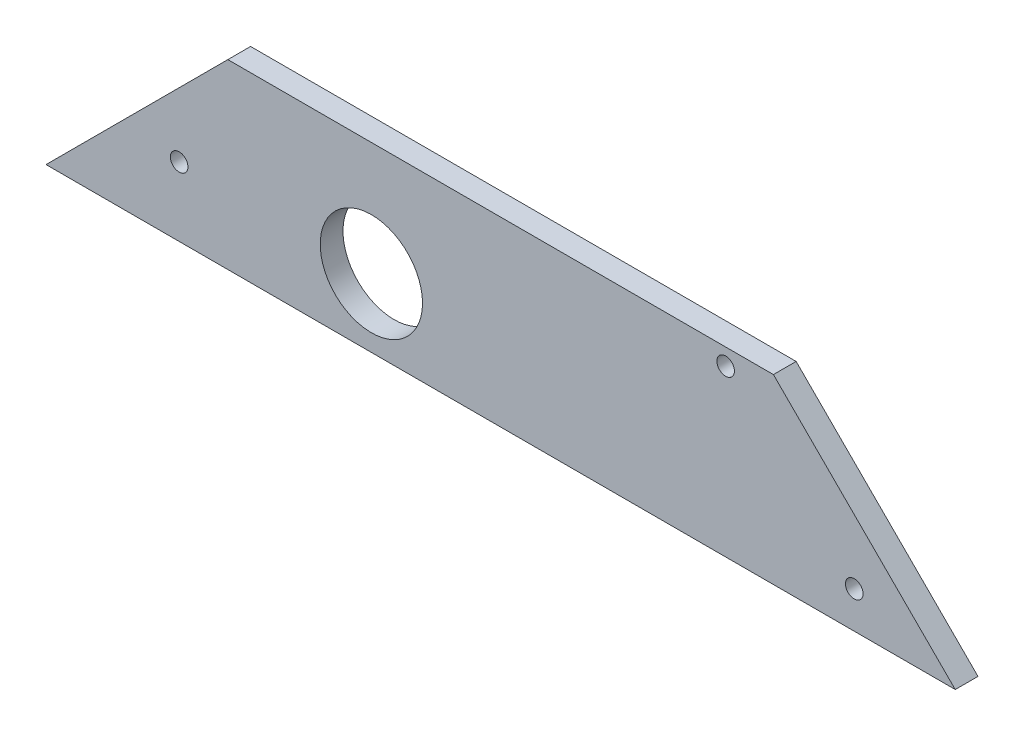
from build123d import *

# Parameters (mm, degrees)
BOSS_EXTRUDE1_DEPTH          = 3.175
SKETCH2_R                    = 14.2875
CUT_EXTRUDE1_DEPTH           = 131.459778054
F_10_0_1935_DIAMETER_HOLE2_D = 4.9149


with BuildPart() as part:
    # Sketch1 → Boss-Extrude1 (new, symmetric)
    with BuildSketch(Plane.XY):
        Polygon((-76.2, 29.162153383), (-127, -21.637846617), (127, -21.637846617), (76.2, 29.162153383), align=None)
    extrude(amount=BOSS_EXTRUDE1_DEPTH, both=True)

    # Sketch2 → Cut-Extrude1 (cut, through all)
    with BuildSketch(Plane.XY.offset(3.175)):
        with Locations((-36.107951031, -2.587846617)):
            Circle(SKETCH2_R)
    extrude(amount=-CUT_EXTRUDE1_DEPTH, mode=Mode.SUBTRACT)

    # #10 (0.1935) Diameter Hole2 (through all)
    with Locations(Plane(origin=(62.861792847, 24.539848294, 3.175), x_dir=(1, 0, 0), z_dir=(0, 0, 1))):
        with Locations((0, 0), (35.921024485, -35.921024485), (-152.664354058, -26.940768364)):
            Hole(F_10_0_1935_DIAMETER_HOLE2_D / 2)


solid = part.part
